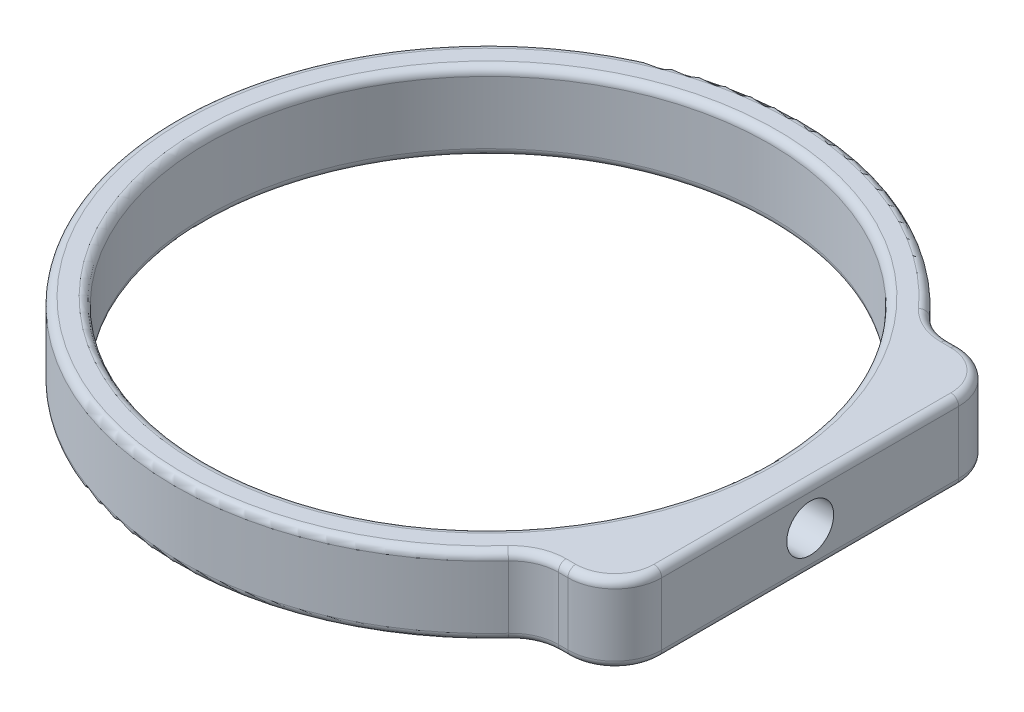
from build123d import *

# Parameters (mm, degrees)
ESQUISSE1_R                  = 9
BOSS_EXTRU_1_DEPTH           = 2.5
ENL_V_MAT_EXTRU_1_REACH      = 24.773
ENL_V_MAT_EXTRU_1_END_RADIUS = 9
ESQUISSE2_R                  = 0.75
CONG_1_R                     = 1.5
CONG_2_R                     = 0.25


with BuildPart() as part:
    # Esquisse1 → Boss.-Extru.1 (new body)
    with BuildSketch(Plane(origin=(0, 0, 0), x_dir=(1, 0, 0), z_dir=(0, 1, 0))):
        with BuildLine():
            Line((7.806247498, 6.25), (10.306247498, 6.25))
            Line((10.306247498, 6.25), (10.306247498, -6.25))
            Line((10.306247498, -6.25), (7.806247498, -6.25))
            ThreePointArc((7.806247498, -6.25), (-10, 0), (7.806247498, 6.25))
        make_face()
        with Locations(Location((0, 0, 0), (0, 0, 270))):
            Circle(ESQUISSE1_R, mode=Mode.SUBTRACT)
    extrude(amount=BOSS_EXTRU_1_DEPTH)

    # Enlèv. mat.-Extru.1: up to this cylinder (the profile starts outside it)
    enl_v_mat_extru_1_end = Plane(origin=(0, 1.25, 0), z_dir=(0, -1, 0)) * Cylinder(ENL_V_MAT_EXTRU_1_END_RADIUS, 68.546, mode=Mode.PRIVATE)
    # Esquisse2 → Enlèv. mat.-Extru.1 (cut, up to the surface)
    with BuildSketch(Plane(origin=(10.306247498, 0, 0), x_dir=(0, 0, -1), z_dir=(1, 0, 0)), mode=Mode.PRIVATE) as enl_v_mat_extru_1_sk1:
        with Locations((0, 1.25)):
            Circle(ESQUISSE2_R)
    enl_v_mat_extru_1_tool1 = extrude(enl_v_mat_extru_1_sk1.sketch, amount=-ENL_V_MAT_EXTRU_1_REACH, mode=Mode.PRIVATE) - enl_v_mat_extru_1_end
    add(enl_v_mat_extru_1_tool1.solids().sort_by_distance((10.306247, 1.25, 0))[0], mode=Mode.SUBTRACT)

    # Congé1
    cong_1_edges = [part.edges().sort_by_distance(p)[0] for p in [
        (7.806247498, 1.25, -6.25),
        (10.306247498, 1.25, -6.25),
        (10.306247498, 1.25, 6.25),
        (7.806247498, 1.25, 6.25),
    ]]
    fillet(cong_1_edges, radius=CONG_1_R)

    # Congé2
    cong_2_edges = [part.edges().sort_by_distance(p)[0] for p in [
        (0, 0, -9),
        (0, 2.5, -9),
        (10.306247498, 0, 0),
        (10.306247498, 2.5, 0),
        (-10, 0, 0),
        (8.651285116, 0, -6.25),
        (8.651285116, 0, 6.25),
        (9.86690767, 0, -5.810660172),
        (9.86690767, 0, 5.810660172),
        (8.651285116, 2.5, 6.25),
        (-10, 2.5, 0),
        (8.651285116, 2.5, -6.25),
        (9.86690767, 2.5, -5.810660172),
        (9.86690767, 2.5, 5.810660172),
        (7.890643094, 0, 6.377720082),
        (7.890643094, 2.5, 6.377720082),
        (7.890643094, 0, -6.377720082),
        (7.890643094, 2.5, -6.377720082),
    ]]
    fillet(cong_2_edges, radius=CONG_2_R)


solid = part.part
